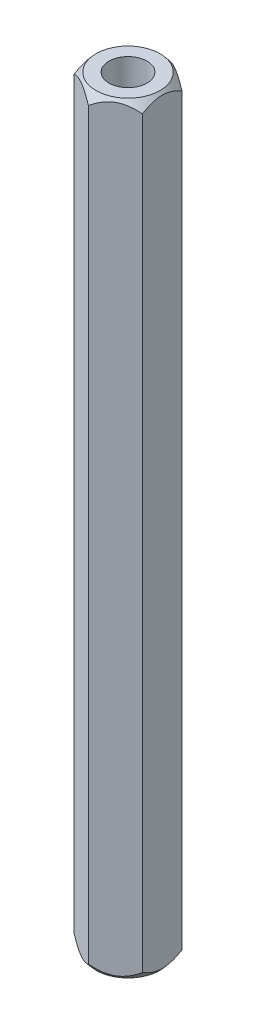
from build123d import *

# Parameters (mm, degrees)
SKETCH1_R           = 1.25
BOSS_EXTRUDE1_DEPTH = 50


with BuildPart() as part:
    # Sketch1 → Boss-Extrude1 (new body)
    with BuildSketch(Plane(origin=(0, 0, 0), x_dir=(1, 0, 0), z_dir=(0, 1, 0))):
        Polygon((0, 2.598076211), (-2.25, 1.299038106), (-2.25, -1.299038106), (0, -2.598076211), (2.25, -1.299038106), (2.25, 1.299038106), align=None)
        with Locations(Location((0, 0, 0), (0, 0, 270))):
            Circle(SKETCH1_R, mode=Mode.SUBTRACT)
    extrude(amount=BOSS_EXTRUDE1_DEPTH)

    # Sketch2 → Cut-Revolve1 (revolve, cut)
    with BuildSketch(Plane(origin=(0, 0, 0), x_dir=(0, 0, -1), z_dir=(1, 0, 0))):
        Polygon((-2.098076211, 50), (-2.598076211, 49.4), (-2.598076211, 50), align=None)
    cut_revolve1 = revolve(axis=Axis((0, 50, 0), (0, -1, 0)), mode=Mode.SUBTRACT)

    # Mirror1: Cut-Revolve1 across plane
    add(cut_revolve1.mirror(Plane.ZX.offset(25)), mode=Mode.SUBTRACT)


solid = part.part
